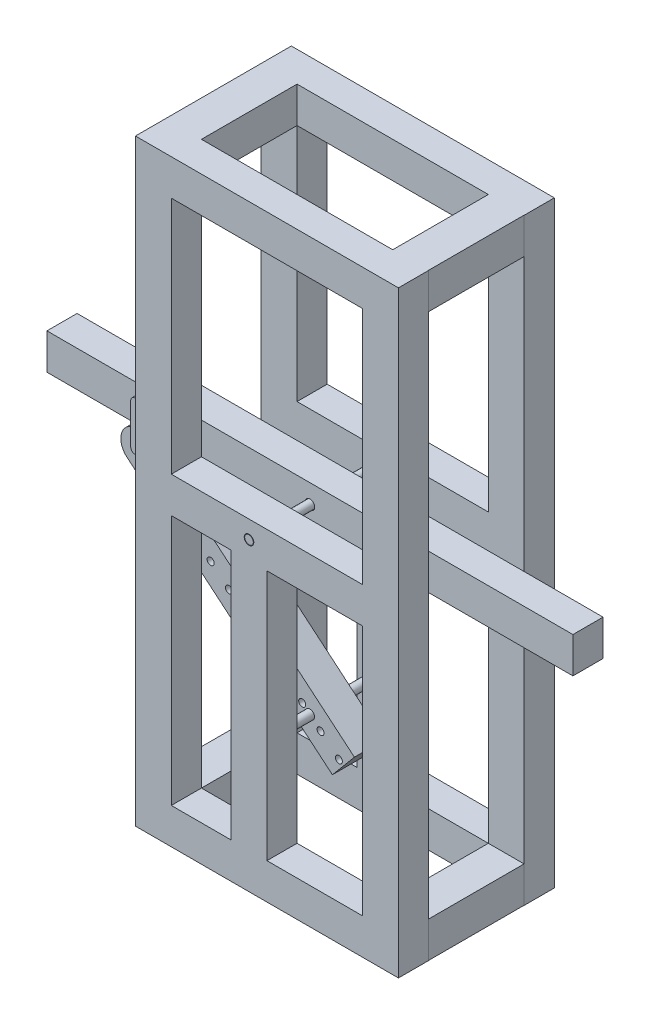
from build123d import *

# Parameters (mm, degrees)
ESQUISSE1_W                = 550
ESQUISSE1_H                = 1250
ESQUISSE1_W_2              = 125
ESQUISSE1_H_2              = 525
ESQUISSE1_W_3              = 200
ESQUISSE1_W_4              = 400
ESQUISSE1_H_3              = 500
BOSS_EXTRU_1_DEPTH         = 63
R_P_TITION_LIN_AIRE1_COUNT = 2
R_P_TITION_LIN_AIRE1_PITCH = 263
ESQUISSE2_W                = 75
ESQUISSE2_H                = 75
ESQUISSE2_W_2              = 74.718169062
BOSS_EXTRU_2_DEPTH         = 200
BOSS_EXTRU_4_DEPTH         = 550
BOSS_EXTRU_4_DEPTH_BACK    = 550
ESQUISSE7_W                = 63
ESQUISSE7_H                = 75
ESQUISSE3_R                = 10
ENL_V_MAT_EXTRU_2_DEPTH    = 1513.921759378
BOSS_EXTRU_5_DEPTH         = 63
BOSS_EXTRU_6_DEPTH         = 5
ESQUISSE12_R               = 7.355365699
ENL_V_MAT_EXTRU_3_DEPTH    = 100
R_P_TITION_LIN_AIRE2_COUNT = 12
R_P_TITION_LIN_AIRE2_PITCH = 50
BOSS_EXTRU_7_START         = -263
ESQUISSE13_R               = 9.503964929
BOSS_EXTRU_7_DEPTH         = 200
R_P_TITION_LIN_AIRE3_COUNT = 2
R_P_TITION_LIN_AIRE3_PITCH = 66
ESQUISSE14_R               = 9
BOSS_EXTRU_8_DEPTH         = 326


with BuildPart() as part:
    # Esquisse1 → Boss.-Extru.1 (new body)
    with BuildSketch(Plane.XY):
        with Locations((275, 625)):
            Rectangle(ESQUISSE1_W, ESQUISSE1_H)
        with Locations((137.5, 337.5)):
            Rectangle(ESQUISSE1_W_2, ESQUISSE1_H_2, mode=Mode.SUBTRACT)
        with Locations((375, 337.5)):
            Rectangle(ESQUISSE1_W_3, ESQUISSE1_H_2, mode=Mode.SUBTRACT)
        with Locations((275, 925)):
            Rectangle(ESQUISSE1_W_4, ESQUISSE1_H_3, mode=Mode.SUBTRACT)
    extrude(amount=BOSS_EXTRU_1_DEPTH)


with BuildPart() as r_p_tition_lin_aire1_1:
    # Répétition linéaire1: pattern copy
    add(part.part.moved(Location(Vector(0, 0, 1) * (1 * R_P_TITION_LIN_AIRE1_PITCH))))


with BuildPart() as part_1:
    add(part.part)

    add(r_p_tition_lin_aire1_1.part)  # Boss.-Extru.2 merges Répétition linéaire1_1
    # Esquisse2 → Boss.-Extru.2 (add)
    with BuildSketch(Plane.XY.offset(63)):
        with Locations((37.5, 37.5)):
            Rectangle(ESQUISSE2_W, ESQUISSE2_H)
        with Locations((512.359084531, 37.5)):
            Rectangle(ESQUISSE2_W_2, ESQUISSE2_H)
        with Locations((512.359084531, 1212.5)):
            Rectangle(ESQUISSE2_W_2, ESQUISSE2_H)
        with Locations((37.5, 1212.5)):
            Rectangle(ESQUISSE2_W, ESQUISSE2_H)
    extrude(amount=BOSS_EXTRU_2_DEPTH)


with BuildPart() as body_2:
    # Esquisse7 → Boss.-Extru.4 (new, two sides: drawn at the far end of the back side and taken through both)
    with BuildSketch(Plane.ZY.offset(-237.5).offset(-BOSS_EXTRU_4_DEPTH_BACK)):
        with Locations((167.0850662, 639.649163537)):
            Rectangle(ESQUISSE7_W, ESQUISSE7_H)
    extrude(amount=BOSS_EXTRU_4_DEPTH + BOSS_EXTRU_4_DEPTH_BACK)


with BuildPart() as enl_v_mat_extru_2_tool:
    # Esquisse3 → Enlèv. mat.-Extru.2 (new, through all)
    with BuildSketch(Plane.XY.offset(326)):
        with Locations((237.5, 637.5)):
            Circle(ESQUISSE3_R)
    extrude(amount=-ENL_V_MAT_EXTRU_2_DEPTH)


with BuildPart() as part_2:
    add(part_1.part)

    # Enlèv. mat.-Extru.2: cut by enl_v_mat_extru_2_tool
    add(enl_v_mat_extru_2_tool.part, mode=Mode.SUBTRACT)



with BuildPart() as body_2_1:
    add(body_2.part)

    # Enlèv. mat.-Extru.2: cut by enl_v_mat_extru_2_tool
    add(enl_v_mat_extru_2_tool.part, mode=Mode.SUBTRACT)



with BuildPart() as body_3:
    # Esquisse11 → Boss.-Extru.5 (new body)
    with BuildSketch(Plane.XY.offset(198.5850662)):
        with BuildLine():
            Line((-99.153084709, 586.914270743), (330.503621206, 226.557033524))
            Line((330.503621206, 226.557033524), (284.435304351, 171.629424966))
            Line((284.435304351, 171.629424966), (-145.221401564, 531.986662185))
            ThreePointArc((-145.221401564, 531.986662185), (-149.651047416, 582.484624891), (-99.153084709, 586.914270743))
        make_face()
    extrude(amount=-BOSS_EXTRU_5_DEPTH)


with BuildPart() as body_2_2:
    add(body_2_1.part)

    add(body_3.part)  # Boss.-Extru.6 merges body 3
    # Esquisse11<3> → Boss.-Extru.6 (add)
    with BuildSketch(Plane.XY.offset(198.5850662)):
        with BuildLine():
            Line((-114.54998443, 559.450466464), (-114.54998443, 643.613737641))
            ThreePointArc((-114.54998443, 643.613737641), (-123.445013511, 652.508766722), (-132.340042592, 643.613737641))
            Line((-132.340042592, 643.613737641), (-132.340042592, 559.450466464))
            ThreePointArc((-132.340042592, 559.450466464), (-123.445013511, 550.555437383), (-114.54998443, 559.450466464))
        make_face()
    boss_extru_6 = extrude(amount=BOSS_EXTRU_6_DEPTH)

    # Esquisse12 → Enlèv. mat.-Extru.3 (cut)
    with BuildSketch(Plane.XY.offset(198.5850662)):
        with Locations((-123.445013511, 559.450466464)):
            Circle(ESQUISSE12_R)
    enl_v_mat_extru_3 = extrude(amount=-ENL_V_MAT_EXTRU_3_DEPTH, mode=Mode.SUBTRACT)

    # Répétition linéaire2: Enlèv. mat.-Extru.3 ×12
    with Locations(*[Vector(0.7661915431257939, -0.6426122619764696, 0) * (i * R_P_TITION_LIN_AIRE2_PITCH) for i in range(1, R_P_TITION_LIN_AIRE2_COUNT)]):
        add(enl_v_mat_extru_3, mode=Mode.SUBTRACT)


with BuildPart() as part_3:
    add(part_2.part)

    add(body_2_2.part)  # Boss.-Extru.7 merges body 2
    # Esquisse13 → Boss.-Extru.7 (add)
    with BuildSketch(Plane.XY.offset(326).offset(BOSS_EXTRU_7_START)):
        with Locations((237.5, 257.608372702)):
            Circle(ESQUISSE13_R)
    extrude(amount=BOSS_EXTRU_7_DEPTH)

    # Répétition linéaire3: Boss.-Extru.6 ×2
    with Locations(*[(0, 0, -i * R_P_TITION_LIN_AIRE3_PITCH) for i in range(1, R_P_TITION_LIN_AIRE3_COUNT)]):
        add(boss_extru_6)


with BuildPart() as body_2_2_1:
    # Esquisse14 → Boss.-Extru.8 (new body)
    with BuildSketch(Plane.XY.offset(326)):
        with Locations((237.5, 637.5)):
            Circle(ESQUISSE14_R)
    extrude(amount=-BOSS_EXTRU_8_DEPTH)


solid = Compound([part_3.part, body_2_2_1.part])
